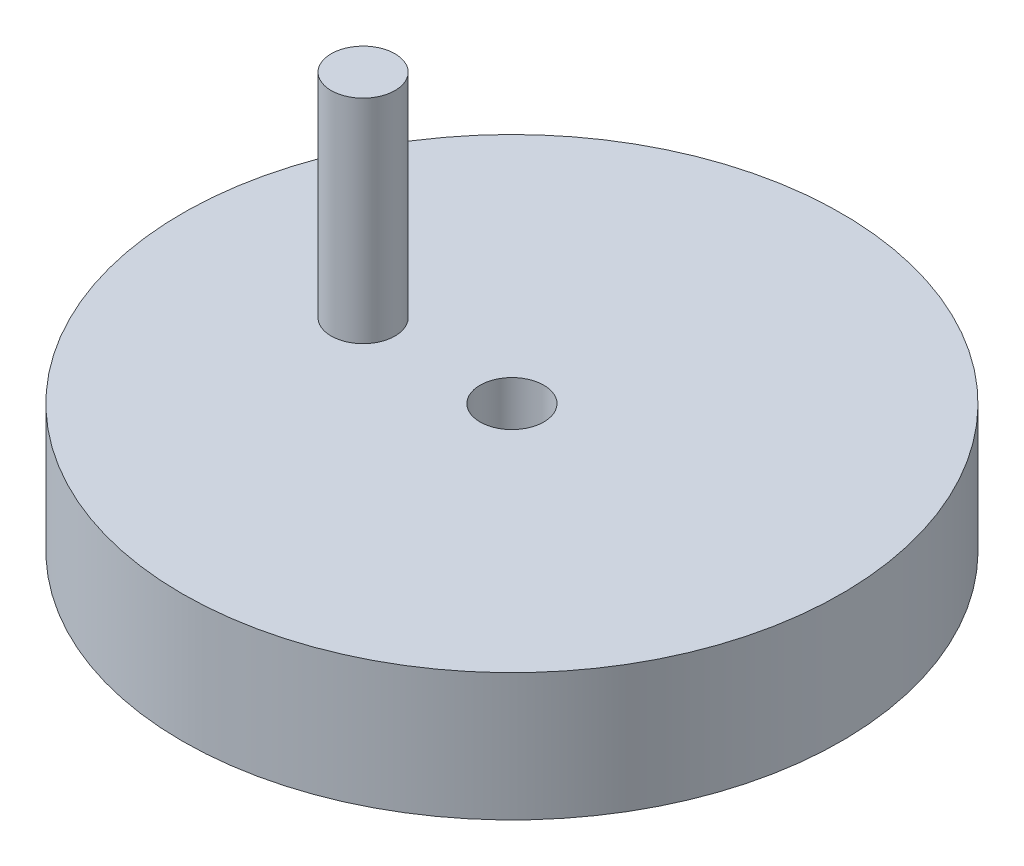
from build123d import *

# Parameters (mm, degrees)
SKETCH1_R           = 31
BOSS_EXTRUDE1_DEPTH = 12
SKETCH2_R           = 3
CUT_EXTRUDE1_DEPTH  = 46.453272709
SKETCH3_R           = 3
BOSS_EXTRUDE2_DEPTH = 20


with BuildPart() as part:
    # Sketch1 → Boss-Extrude1 (new body)
    with BuildSketch(Plane(origin=(0, 0, 0), x_dir=(1, 0, 0), z_dir=(0, 1, 0))):
        with Locations(Location((0, 0, 0), (0, 0, 270))):
            Circle(SKETCH1_R)
    extrude(amount=BOSS_EXTRUDE1_DEPTH)

    # Sketch2 → Cut-Extrude1 (cut, through all)
    with BuildSketch(Plane(origin=(0, 12, 0), x_dir=(1, 0, 0), z_dir=(0, 1, 0))):
        with Locations(Location((0, 0, 0), (0, 0, 270))):
            Circle(SKETCH2_R)
    extrude(amount=-CUT_EXTRUDE1_DEPTH, mode=Mode.SUBTRACT)

    # Sketch3 → Boss-Extrude2 (add)
    with BuildSketch(Plane(origin=(0, 12, 0), x_dir=(1, 0, 0), z_dir=(0, 1, 0))):
        with Locations(Location((-14, 0, 0), (0, 0, 270))):
            Circle(SKETCH3_R)
    extrude(amount=BOSS_EXTRUDE2_DEPTH)


solid = part.part
